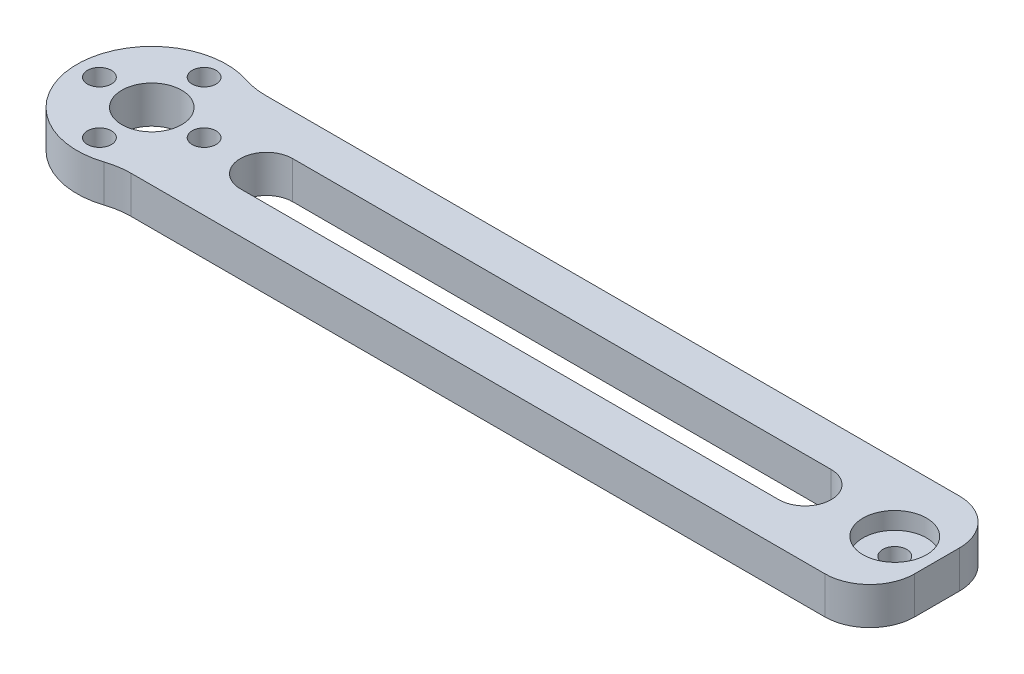
from build123d import *

# Parameters (mm, degrees)
SKETCH_1_R          = 1.6
SKETCH_1_R_2        = 9
SKETCH_1_R_3        = 4
EXTRUDE_1_DEPTH     = 5
SKETCH_2_R          = 4.25
CUT_EXTRUDE_1_DEPTH = 2.3
EXTRUDE_START       = -5
SKETCH_3_R          = 10
SKETCH_3_R_2        = 9
EXTRUDE_2_DEPTH     = 5
FILLET_1_R          = 10


with BuildPart() as part:
    # 草图1 → 凸台-拉伸1 (new body)
    # profile 1 of 2: a face of its own
    with BuildSketch(Plane(origin=(0, 0, 0), x_dir=(1, 0, 0), z_dir=(0, 1, 0))):
        with BuildLine():
            Line((99, 9), (0, 9))
            ThreePointArc((0, 9), (6.363961031, 6.363961031), (9, 0))
            ThreePointArc((9, 0), (6.363961031, -6.363961031), (0, -9))
            Line((0, -9), (99, -9))
            ThreePointArc((99, -9), (103.242640687, -7.242640687), (105, -3))
            Line((105, -3), (105, 3))
            ThreePointArc((105, 3), (103.242640687, 7.242640687), (99, 9))
        make_face()
        with BuildLine():
            ThreePointArc((15.34, -3.5), (11.84, 0), (15.34, 3.5))
            Line((15.34, 3.5), (87.34, 3.5))
            ThreePointArc((87.34, 3.5), (90.84, 0), (87.34, -3.5))
            Line((87.34, -3.5), (15.34, -3.5))
        make_face(mode=Mode.SUBTRACT)
        with Locations(Location((99.34, 0, 0), (0, 0, 270))):
            Circle(SKETCH_1_R, mode=Mode.SUBTRACT)
    # profile 2 of 2: a face of its own
    with BuildSketch(Plane(origin=(0, 0, 0), x_dir=(1, 0, 0), z_dir=(0, 1, 0))):
        Circle(SKETCH_1_R_2)
        with Locations(Location((0, -7, 0), (0, 0, 270))):
            Circle(SKETCH_1_R, mode=Mode.SUBTRACT)
        with Locations(Location((7, 0, 0), (0, 0, 270))):
            Circle(SKETCH_1_R, mode=Mode.SUBTRACT)
        with Locations(Location((0, 7, 0), (0, 0, 270))):
            Circle(SKETCH_1_R, mode=Mode.SUBTRACT)
        with Locations(Location((-7, 0, 0), (0, 0, 270))):
            Circle(SKETCH_1_R, mode=Mode.SUBTRACT)
        with Locations(Location((0, 0, 0), (0, 0, 270))):
            Circle(SKETCH_1_R_3, mode=Mode.SUBTRACT)
    extrude(amount=EXTRUDE_1_DEPTH)

    # 草图2 → 切除-拉伸1 (cut)
    with BuildSketch(Plane(origin=(0, 5, 0), x_dir=(1, 0, 0), z_dir=(0, 1, 0))):
        with Locations(Location((99.34, 0, 0), (0, 0, 270))):
            Circle(SKETCH_2_R)
    extrude(amount=-CUT_EXTRUDE_1_DEPTH, mode=Mode.SUBTRACT)

    # 草图3 → 凸台-拉伸2 (add)
    with BuildSketch(Plane(origin=(0, 5, 0), x_dir=(1, 0, 0), z_dir=(0, 1, 0)).offset(EXTRUDE_START)):
        Circle(SKETCH_3_R)
        Circle(SKETCH_3_R_2, mode=Mode.SUBTRACT)
    extrude(amount=EXTRUDE_2_DEPTH)

    # 圆角1
    fillet_1_edges = [part.edges().sort_by_distance(p)[0] for p in [
        (4.358898944, 2.5, -9),
        (4.358898944, 2.5, 9),
    ]]
    fillet(fillet_1_edges, radius=FILLET_1_R)


solid = part.part
